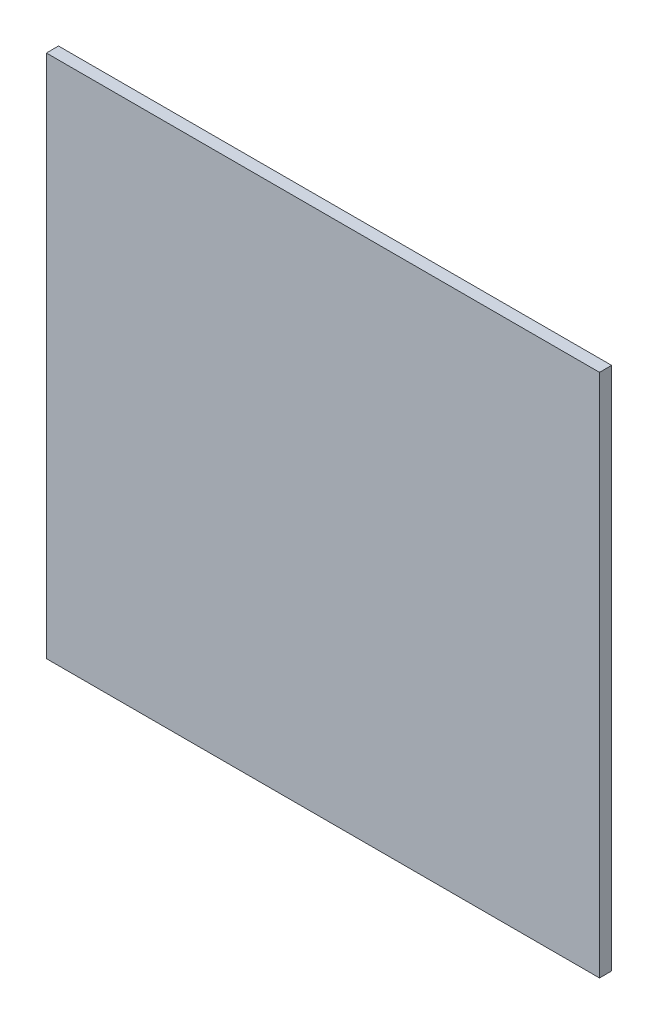
from build123d import *

# Parameters (mm, degrees)
SKETCH1_W           = 290
SKETCH1_H           = 275
BOSS_EXTRUDE1_DEPTH = 6.35


with BuildPart() as part:
    # Sketch1 → Boss-Extrude1 (new body)
    with BuildSketch(Plane.XY):
        Rectangle(SKETCH1_W, SKETCH1_H)
    extrude(amount=BOSS_EXTRUDE1_DEPTH)


solid = part.part
